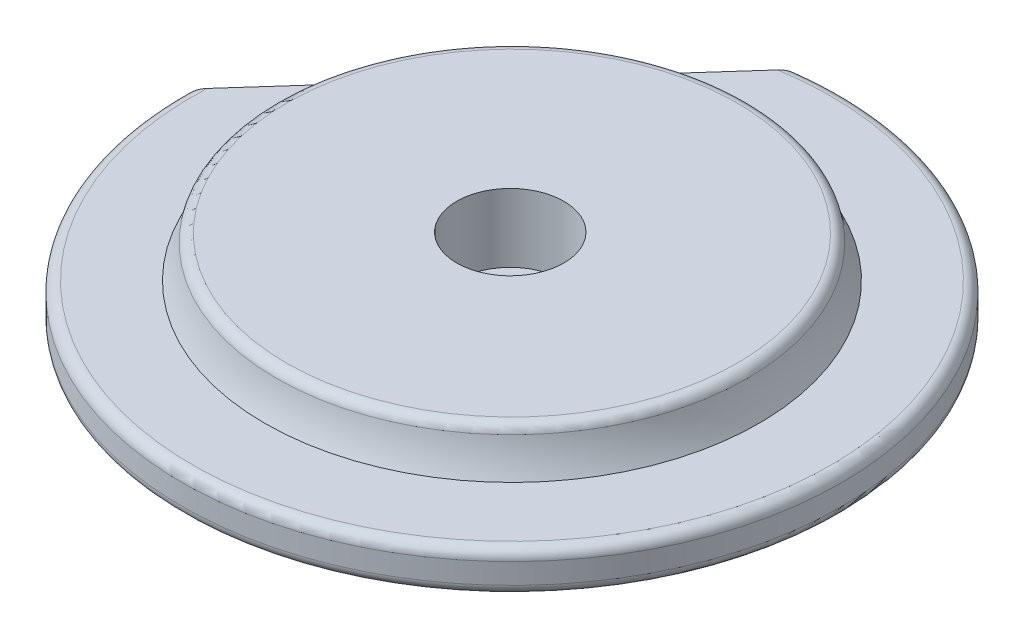
from build123d import *

# Parameters (mm, degrees)
CONG_1_R                                           = 2.5
ENL_V_MAT_EXTRU_1_REACH                            = 181.165
CHAMBRAGE_POUR_VIS_T_TE_HEXAGONALE_M16_D           = 17.5
CHAMBRAGE_POUR_VIS_T_TE_HEXAGONALE_M16_DEPTH       = 20
CHAMBRAGE_POUR_VIS_T_TE_HEXAGONALE_M16_CBORE_D     = 26
CHAMBRAGE_POUR_VIS_T_TE_HEXAGONALE_M16_CBORE_DEPTH = 16.6
CHAMBRAGE_POUR_VIS_T_TE_HEXAGONALE_M16_TIP         = 5.257530416
ECHELLE1_SCALE                                     = 0.25


with BuildPart() as part:
    # Esquisse1 → Révolution1 (revolve)
    with BuildSketch(Plane.XY, mode=Mode.PRIVATE) as r_volution1_sk:
        with BuildLine():
            Line((0, 0), (80, 0))
            Line((80, 0), (80, 20))
            Line((80, 20), (23.203122076, 20))
            ThreePointArc((23.203122076, 20), (22.035240729, 14.861087101), (20, 10))
            Line((20, 10), (0, 10))
            Line((0, 10), (0, 0))
        make_face()
    revolve(r_volution1_sk.sketch.rotate(Axis((80, 20, 0), (0, -1, 0)), 270), axis=Axis((80, 20, 0), (0, -1, 0)))

    # Congé1
    cong_1_edges = [part.edges().sort_by_distance(p)[0] for p in [
        (80, 10, -80),
        (80, 20, -56.796877924),
        (80, 0, -80),
    ]]
    fillet(cong_1_edges, radius=CONG_1_R)

    # Esquisse3 → Enlèv. mat.-Extru.1 (cut, up to next)
    with BuildSketch(Plane(origin=(0, 10, 0), x_dir=(1, 0, 0), z_dir=(0, 1, 0)), mode=Mode.PRIVATE) as enl_v_mat_extru_1_sk1:
        with BuildLine():
            Line((0.001700291, 0.521578063), (70.517699728, 79.436049635))
            ThreePointArc((70.517699728, 79.436049635), (20.346266679, 53.305085132), (0.001700291, 0.521578063))
        make_face()
    enl_v_mat_extru_1_tool1 = extrude(enl_v_mat_extru_1_sk1.sketch, amount=-ENL_V_MAT_EXTRU_1_REACH, mode=Mode.PRIVATE) & part.part
    add(enl_v_mat_extru_1_tool1.solids().sort_by_distance((29.225405, 10, -45.370909))[0], mode=Mode.SUBTRACT)

    # Chambrage pour vis à tête hexagonale M161
    with Locations(Plane(origin=(0, 20, 0), x_dir=(1, 0, 0), z_dir=(0, 1, 0))):
        with Locations((79.591089576, 0)):
            CounterBoreHole(CHAMBRAGE_POUR_VIS_T_TE_HEXAGONALE_M16_D / 2, CHAMBRAGE_POUR_VIS_T_TE_HEXAGONALE_M16_CBORE_D / 2, CHAMBRAGE_POUR_VIS_T_TE_HEXAGONALE_M16_CBORE_DEPTH, depth=CHAMBRAGE_POUR_VIS_T_TE_HEXAGONALE_M16_DEPTH)
            with Locations((0, 0, -(CHAMBRAGE_POUR_VIS_T_TE_HEXAGONALE_M16_DEPTH + CHAMBRAGE_POUR_VIS_T_TE_HEXAGONALE_M16_TIP / 2))):  # 118° drill point
                Cone(0, CHAMBRAGE_POUR_VIS_T_TE_HEXAGONALE_M16_D / 2, CHAMBRAGE_POUR_VIS_T_TE_HEXAGONALE_M16_TIP, mode=Mode.SUBTRACT)


with BuildPart() as part_1:
    # Echelle1: scaled about (82.57091432, 8.513984125, 2.2848071)
    add(part.part.scale(ECHELLE1_SCALE).moved(Location((61.92818574, 6.385488094, 1.713605325))))


solid = part_1.part
